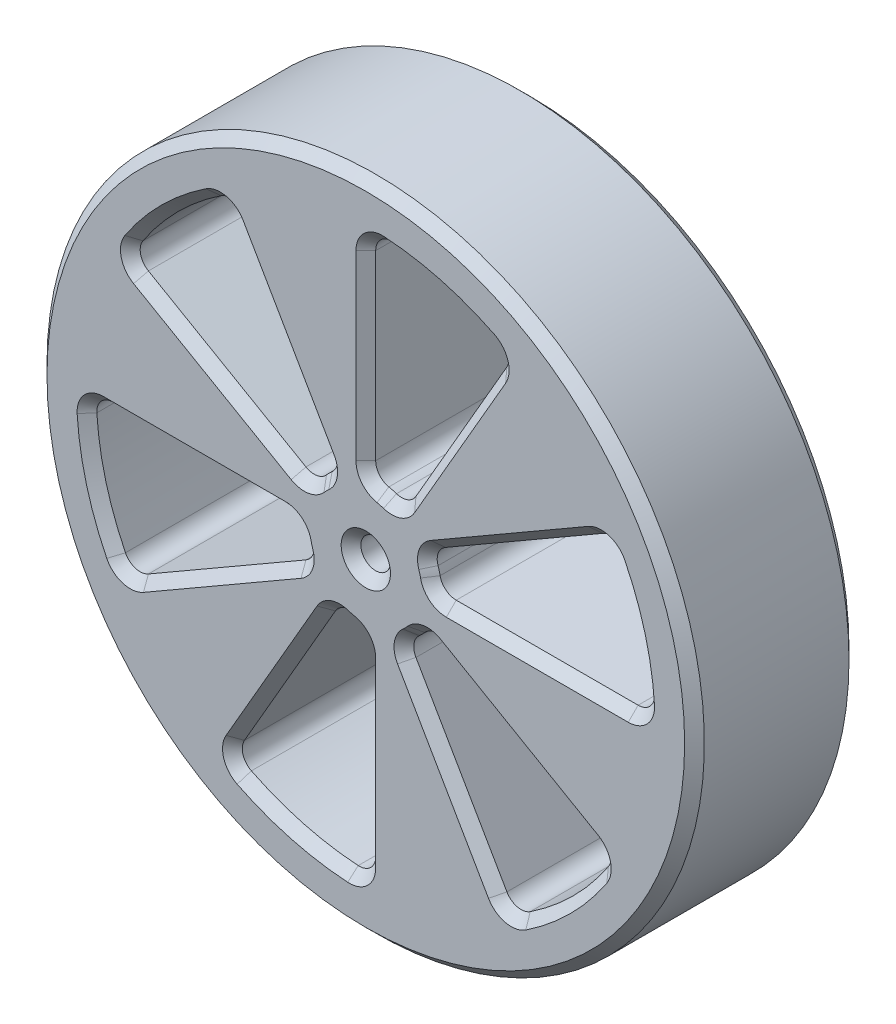
from build123d import *

# Parameters (mm, degrees)
SKETCH1_R           = 100
BOSS_EXTRUDE1_DEPTH = 50
CUT_EXTRUDE1_DEPTH  = 151
CIRPATTERN1_COUNT   = 6
FILLET1_R           = 5
SKETCH3_R           = 4.5
CUT_EXTRUDE2_DEPTH  = 151
CHAMFER1_SIZE       = 3


with BuildPart() as part:
    # Sketch1 → Boss-Extrude1 (new body)
    with BuildSketch(Plane.XY):
        Circle(SKETCH1_R)
    extrude(amount=BOSS_EXTRUDE1_DEPTH)

    # Sketch2 → Cut-Extrude1 (cut, through all)
    with BuildSketch(Plane.XY.offset(50)):
        with BuildLine():
            Line((0, 85), (0, 20))
            ThreePointArc((0, 20), (5.176380902, 19.318516526), (10, 17.320508076))
            Line((10, 17.320508076), (42.5, 73.612159322))
            ThreePointArc((42.5, 73.612159322), (21.999618834, 82.103695235), (0, 85))
        make_face()
    cut_extrude1 = extrude(amount=-CUT_EXTRUDE1_DEPTH, mode=Mode.SUBTRACT)

    # CirPattern1: Cut-Extrude1 ×6 about axis
    cirpattern1_axis = Axis((0, 0, 0), (0, 0, 1))
    for i in range(1, CIRPATTERN1_COUNT):
        add(cut_extrude1.rotate(cirpattern1_axis, i * 360 / CIRPATTERN1_COUNT), mode=Mode.SUBTRACT)

    # Fillet1
    fillet1_edges = [part.edges().sort_by_distance(p)[0] for p in [
        (42.5, 73.612159322, 25),
        (10, 17.320508076, 25),
        (0, 20, 25),
        (0, 85, 25),
        (85, 0, 25),
        (20, 0, 25),
        (17.320508076, 10, 25),
        (73.612159322, 42.5, 25),
        (42.5, -73.612159322, 25),
        (10, -17.320508076, 25),
        (17.320508076, -10, 25),
        (73.612159322, -42.5, 25),
        (-85, 0, 25),
        (-20, 0, 25),
        (-17.320508076, -10, 25),
        (-73.612159322, -42.5, 25),
        (-42.5, -73.612159322, 25),
        (-10, -17.320508076, 25),
        (0, -20, 25),
        (0, -85, 25),
        (-42.5, 73.612159322, 25),
        (-10, 17.320508076, 25),
        (-17.320508076, 10, 25),
        (-73.612159322, 42.5, 25),
    ]]
    fillet(fillet1_edges, radius=FILLET1_R)

    # Sketch3 → Cut-Extrude2 (cut, through all)
    with BuildSketch(Plane.XY.offset(50)):
        Circle(SKETCH3_R)
    extrude(amount=-CUT_EXTRUDE2_DEPTH, mode=Mode.SUBTRACT)

    # Chamfer1
    chamfer1_edges = [part.edges().sort_by_distance(p)[0] for p in [
        (21.999618834, 82.103695235, 50),
        (21.999618834, 82.103695235, 0),
        (26.084623635, 45.179893433, 50),
        (26.084623635, 45.179893433, 0),
        (5.176380902, 19.318516526, 50),
        (5.176380902, 19.318516526, 0),
        (-14.142135624, 14.142135624, 50),
        (-14.142135624, 14.142135624, 0),
        (-45.179893433, 26.084623635, 50),
        (-45.179893433, 26.084623635, 0),
        (-60.104076401, 60.104076401, 50),
        (-60.104076401, 60.104076401, 0),
        (-26.084623635, 45.179893433, 50),
        (-26.084623635, 45.179893433, 0),
        (-5.176380902, -19.318516526, 50),
        (-5.176380902, -19.318516526, 0),
        (0, -52.169247271, 50),
        (0, -52.169247271, 0),
        (-21.999618834, -82.103695235, 50),
        (-21.999618834, -82.103695235, 0),
        (-26.084623635, -45.179893433, 50),
        (-26.084623635, -45.179893433, 0),
        (-19.318516526, -5.176380902, 50),
        (-19.318516526, -5.176380902, 0),
        (-45.179893433, -26.084623635, 50),
        (-45.179893433, -26.084623635, 0),
        (-82.103695235, -21.999618834, 50),
        (-82.103695235, -21.999618834, 0),
        (-52.169247271, 0, 50),
        (-52.169247271, 0, 0),
        (14.142135624, -14.142135624, 50),
        (14.142135624, -14.142135624, 0),
        (45.179893433, -26.084623635, 50),
        (45.179893433, -26.084623635, 0),
        (60.104076401, -60.104076401, 50),
        (60.104076401, -60.104076401, 0),
        (26.084623635, -45.179893433, 50),
        (26.084623635, -45.179893433, 0),
        (19.318516526, 5.176380902, 50),
        (19.318516526, 5.176380902, 0),
        (45.179893433, 26.084623635, 50),
        (45.179893433, 26.084623635, 0),
        (82.103695235, 21.999618834, 50),
        (82.103695235, 21.999618834, 0),
        (52.169247271, 0, 50),
        (52.169247271, 0, 0),
        (1.576734016, 83.487942048, 50),
        (1.576734016, 83.487942048, 0),
        (40.378479311, 73.091045731, 50),
        (40.378479311, 73.091045731, 0),
        (9.690284831, 19.038098975, 50),
        (9.690284831, 19.038098975, 0),
        (-17.911082321, 11.642334937, 50),
        (-17.911082321, 11.642334937, 0),
        (-71.514311715, 43.109462736, 50),
        (-71.514311715, 43.109462736, 0),
        (-43.109462736, 71.514311715, 50),
        (-43.109462736, 71.514311715, 0),
        (-11.642334937, 17.911082321, 50),
        (-11.642334937, 17.911082321, 0),
        (-1.127016654, -21.332619768, 50),
        (-1.127016654, -21.332619768, 0),
        (-1.576734016, -83.487942048, 50),
        (-1.576734016, -83.487942048, 0),
        (-40.378479311, -73.091045731, 50),
        (-40.378479311, -73.091045731, 0),
        (-9.690284831, -19.038098975, 50),
        (-9.690284831, -19.038098975, 0),
        (-19.038098975, -9.690284831, 50),
        (-19.038098975, -9.690284831, 0),
        (-73.091045731, -40.378479311, 50),
        (-73.091045731, -40.378479311, 0),
        (-83.487942048, -1.576734016, 50),
        (-83.487942048, -1.576734016, 0),
        (-21.332619768, -1.127016654, 50),
        (-21.332619768, -1.127016654, 0),
        (17.911082321, -11.642334937, 50),
        (17.911082321, -11.642334937, 0),
        (71.514311715, -43.109462736, 50),
        (71.514311715, -43.109462736, 0),
        (43.109462736, -71.514311715, 50),
        (43.109462736, -71.514311715, 0),
        (11.642334937, -17.911082321, 50),
        (11.642334937, -17.911082321, 0),
        (19.038098975, 9.690284831, 50),
        (19.038098975, 9.690284831, 0),
        (73.091045731, 40.378479311, 50),
        (73.091045731, 40.378479311, 0),
        (83.487942048, 1.576734016, 50),
        (83.487942048, 1.576734016, 0),
        (21.332619768, 1.127016654, 50),
        (21.332619768, 1.127016654, 0),
        (1.127016654, 21.332619768, 50),
        (1.127016654, 21.332619768, 0),
        (-100, 0, 0),
        (-4.5, 0, 0),
        (-4.5, 0, 50),
        (-100, 0, 50),
        (0, 52.169247271, 50),
        (0, 52.169247271, 0),
    ]]
    chamfer(chamfer1_edges, length=CHAMFER1_SIZE)


solid = part.part
